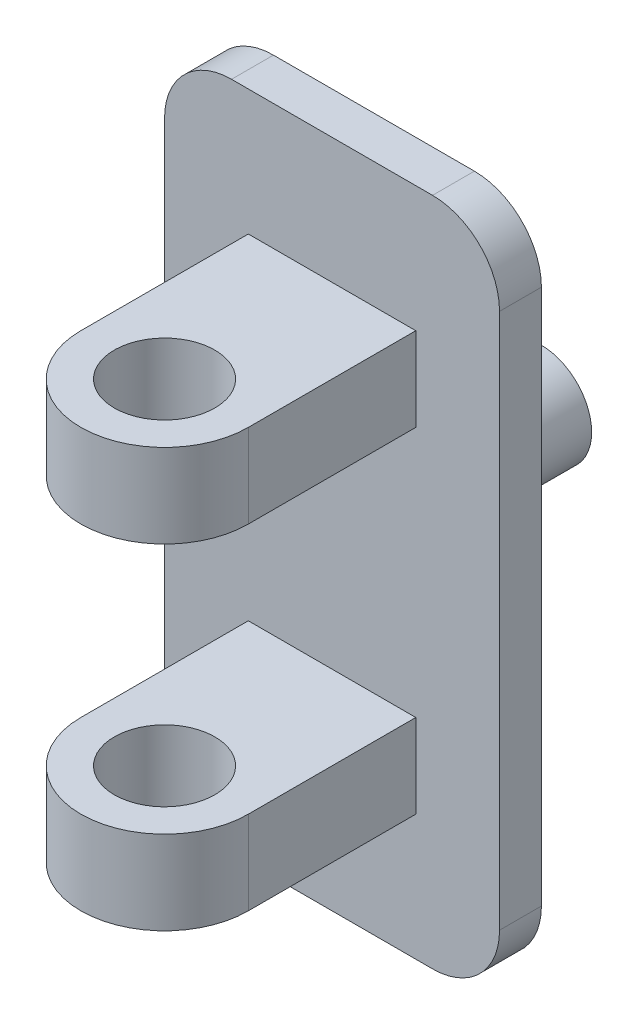
from build123d import *

# Parameters (mm, degrees)
SKETCH2_R           = 1.905
BOSS_EXTRUDE1_DEPTH = 3.175
SKETCH3_W           = 12.7
SKETCH3_H           = 25.4
BOSS_EXTRUDE2_DEPTH = 1.5875
SKETCH5_R           = 1.905
BOSS_EXTRUDE3_DEPTH = 1.5875
FILLET1_R           = 2.54


with BuildPart() as part:
    # Sketch2 → Boss-Extrude1 (new, symmetric)
    with BuildSketch(Plane.XY):
        Circle(SKETCH2_R)
    extrude(amount=BOSS_EXTRUDE1_DEPTH, both=True)

    # Sketch3 → Boss-Extrude2 (add)
    with BuildSketch(Plane.XY.offset(3.175)):
        Rectangle(SKETCH3_W, SKETCH3_H)
    extrude(amount=BOSS_EXTRUDE2_DEPTH)

    # Sketch5 → Boss-Extrude3 (add, symmetric)
    with BuildSketch(Plane(origin=(0, 6.35, 0), x_dir=(1, 0, 0), z_dir=(0, 1, 0))):
        with BuildLine():
            Line((-3.175, -4.7625), (3.175, -4.7625))
            Line((3.175, -4.7625), (3.175, -11.1125))
            ThreePointArc((3.175, -11.1125), (0, -14.2875), (-3.175, -11.1125))
            Line((-3.175, -11.1125), (-3.175, -4.7625))
        make_face()
        with Locations(Location((0, -11.1125, 0), (0, 0, 270))):
            Circle(SKETCH5_R, mode=Mode.SUBTRACT)
    boss_extrude3 = extrude(amount=BOSS_EXTRUDE3_DEPTH, both=True)

    # Mirror1: Boss-Extrude3 across plane
    add(boss_extrude3.mirror(Plane.ZX))

    # Fillet1
    fillet1_edges = [part.edges().sort_by_distance(p)[0] for p in [
        (6.35, -12.7, 3.96875),
        (6.35, 12.7, 3.96875),
        (-6.35, 12.7, 3.96875),
        (-6.35, -12.7, 3.96875),
    ]]
    fillet(fillet1_edges, radius=FILLET1_R)


solid = part.part
